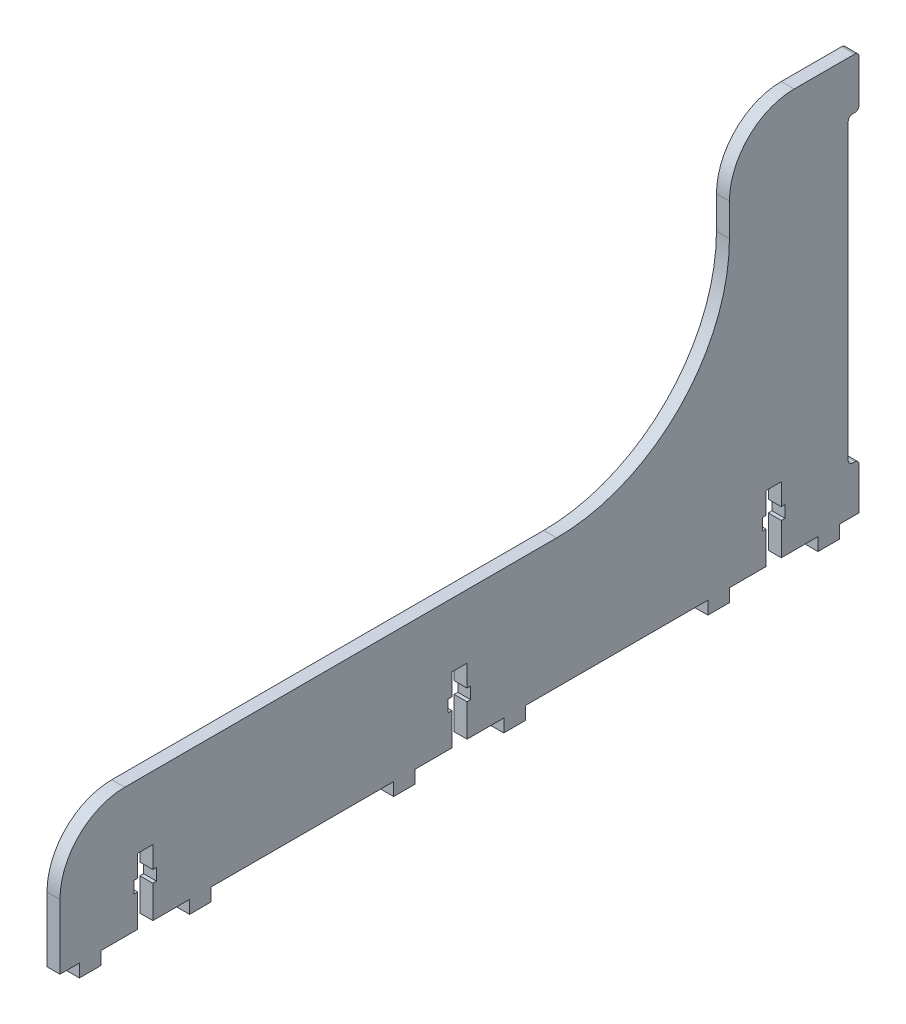
from build123d import *

# Parameters (mm, degrees)
BOSS_EXTRUDE1_DEPTH = 3


with BuildPart() as part:
    # Sketch1 → Boss-Extrude1 (new, symmetric)
    with BuildSketch(Plane(origin=(0, 0, 0), x_dir=(0, 0, -1), z_dir=(1, 0, 0))):
        with BuildLine():
            ThreePointArc((185, 90.5), (184.414213562, 91.914213562), (183, 92.5))
            Line((183, 92.5), (155, 92.5))
            ThreePointArc((155, 92.5), (133.786796564, 83.713203436), (125, 62.5))
            Line((125, 62.5), (125, 47.5))
            ThreePointArc((125, 47.5), (101.568542495, -9.068542495), (45, -32.5))
            Line((45, -32.5), (-155, -32.5))
            ThreePointArc((-155, -32.5), (-176.213203436, -41.286796564), (-185, -62.5))
            Line((-185, -62.5), (-185, -92.5))
            Line((-185, -92.5), (-176, -92.5))
            Line((-176, -92.5), (-176, -98.5))
            Line((-176, -98.5), (-166, -98.5))
            Line((-166, -98.5), (-166, -92.5))
            Line((-166, -92.5), (-149, -92.5))
            Line((-149, -92.5), (-149, -77.5))
            Line((-149, -77.5), (-150.7, -77.5))
            Line((-150.7, -77.5), (-150.7, -72))
            Line((-150.7, -72), (-149, -72))
            Line((-149, -72), (-149, -62))
            Line((-149, -62), (-142, -62))
            Line((-142, -62), (-142, -72))
            Line((-142, -72), (-140.3, -72))
            Line((-140.3, -72), (-140.3, -77.5))
            Line((-140.3, -77.5), (-142, -77.5))
            Line((-142, -77.5), (-142, -92.5))
            Line((-142, -92.5), (-125, -92.5))
            Line((-125, -92.5), (-125, -98.5))
            Line((-125, -98.5), (-115, -98.5))
            Line((-115, -98.5), (-115, -92.5))
            Line((-115, -92.5), (-30.5, -92.5))
            Line((-30.5, -92.5), (-30.5, -98.5))
            Line((-30.5, -98.5), (-20.5, -98.5))
            Line((-20.5, -98.5), (-20.5, -92.5))
            Line((-20.5, -92.5), (-3.5, -92.5))
            Line((-3.5, -92.5), (-3.5, -77.5))
            Line((-3.5, -77.5), (-5.2, -77.5))
            Line((-5.2, -77.5), (-5.2, -72))
            Line((-5.2, -72), (-3.5, -72))
            Line((-3.5, -72), (-3.5, -62))
            Line((-3.5, -62), (3.5, -62))
            Line((3.5, -62), (3.5, -72))
            Line((3.5, -72), (5.2, -72))
            Line((5.2, -72), (5.2, -77.5))
            Line((5.2, -77.5), (3.5, -77.5))
            Line((3.5, -77.5), (3.5, -92.5))
            Line((3.5, -92.5), (20.5, -92.5))
            Line((20.5, -92.5), (20.5, -98.5))
            Line((20.5, -98.5), (30.5, -98.5))
            Line((30.5, -98.5), (30.5, -92.5))
            Line((30.5, -92.5), (115, -92.5))
            Line((115, -92.5), (115, -98.5))
            Line((115, -98.5), (125, -98.5))
            Line((125, -98.5), (125, -92.5))
            Line((125, -92.5), (142, -92.5))
            Line((142, -92.5), (142, -77.5))
            Line((142, -77.5), (140.3, -77.5))
            Line((140.3, -77.5), (140.3, -72))
            Line((140.3, -72), (142, -72))
            Line((142, -72), (142, -62))
            Line((142, -62), (149, -62))
            Line((149, -62), (149, -72))
            Line((149, -72), (150.7, -72))
            Line((150.7, -72), (150.7, -77.5))
            Line((150.7, -77.5), (149, -77.5))
            Line((149, -77.5), (149, -92.5))
            Line((149, -92.5), (166, -92.5))
            Line((166, -92.5), (166, -98.5))
            Line((166, -98.5), (176, -98.5))
            Line((176, -98.5), (176, -92.5))
            Line((176, -92.5), (185, -92.5))
            Line((185, -92.5), (185, -73))
            ThreePointArc((185, -73), (184.414213562, -71.585786438), (183, -71))
            Line((183, -71), (182, -71))
            ThreePointArc((182, -71), (180.585786438, -70.414213562), (180, -69))
            Line((180, -69), (180, 67))
            ThreePointArc((180, 67), (180.585786438, 68.414213562), (182, 69))
            Line((182, 69), (183, 69))
            ThreePointArc((183, 69), (184.414213562, 69.585786438), (185, 71))
            Line((185, 71), (185, 90.5))
        make_face()
    extrude(amount=BOSS_EXTRUDE1_DEPTH, both=True)


solid = part.part
